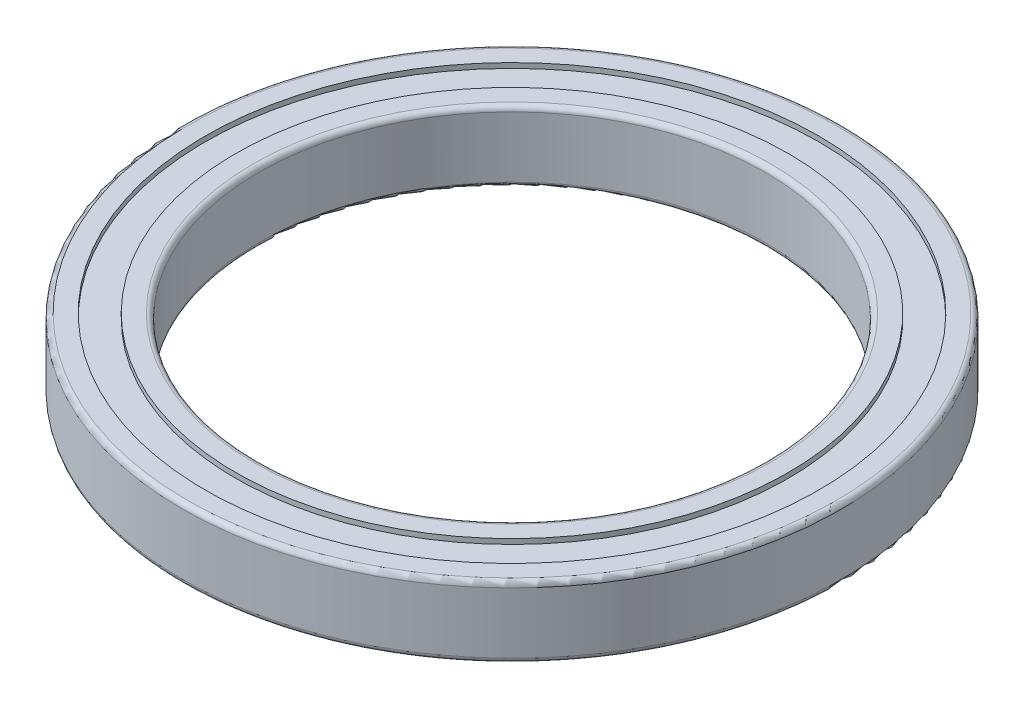
from build123d import *

# Parameters (mm, degrees)
VERRUNDUNG1_R = 0.5


with BuildPart() as part:
    # Skizze1 → Rotation1 (revolve)
    with BuildSketch(Plane.XY, mode=Mode.PRIVATE) as rotation1_sk:
        Polygon((25, 0), (27.25, 0), (27.25, 0.5), (30.25, 0.5), (30.25, 0), (32.5, 0), (32.5, 7), (30.25, 7), (30.25, 6.5), (27.25, 6.5), (27.25, 7), (25, 7), align=None)
    revolve(rotation1_sk.sketch.rotate(Axis((0, 0, 0), (0, 1, 0)), 90), axis=Axis((0, 0, 0), (0, 1, 0)))

    # Verrundung1
    verrundung1_edges = [part.edges().sort_by_distance(p)[0] for p in [
        (0, 7, 32.5),
        (0, 0, 32.5),
        (0, 0, 25),
        (0, 7, 25),
    ]]
    fillet(verrundung1_edges, radius=VERRUNDUNG1_R)


solid = part.part
